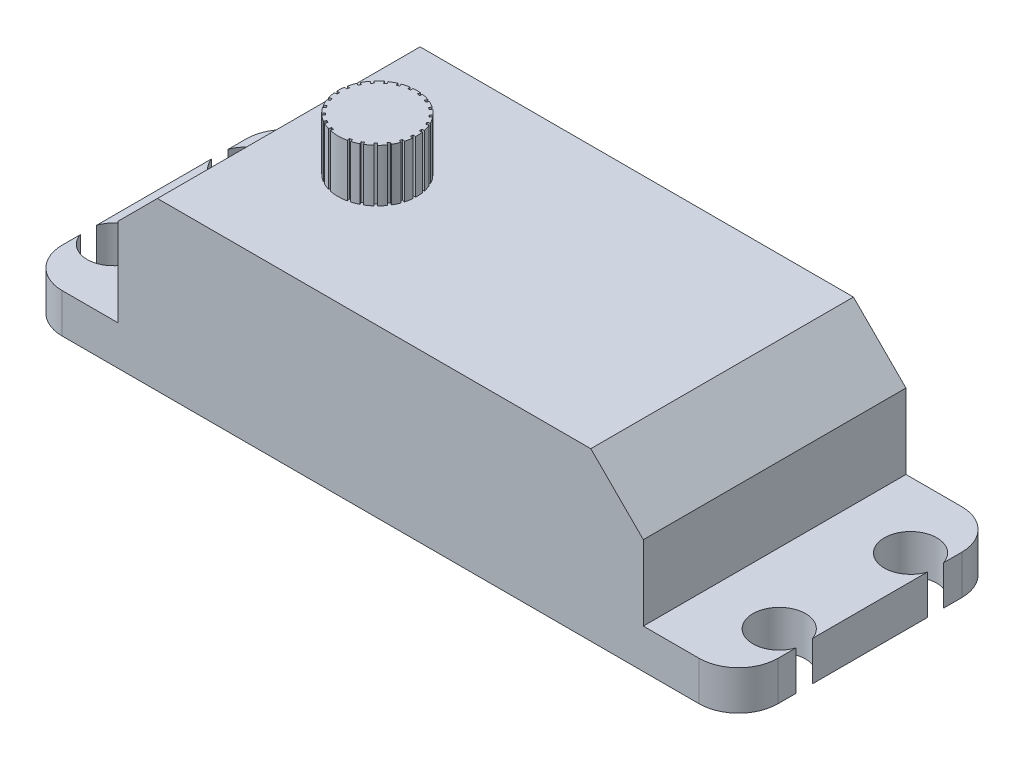
from build123d import *

# Parameters (mm, degrees)
SKETCH_1_W               = 40
SKETCH_1_H               = 12.7
EXTRUDE_1_DEPTH          = 20
EXTRUDE_4_DEPTH          = 3
SKETCH_4_R               = 2
CUT_EXTRUDE_1_DEPTH      = 3
CHAMFER_2_SIZE           = 4
CHAMFER_3_SIZE           = 3
SKETCH_5_R               = 3
EXTRUDE_5_DEPTH          = 4
SKETCH_6_W               = 0.2
SKETCH_6_H               = 4
CUT_EXTRUDE_2_DEPTH      = 0.2
PATTERN_CIRCULAR_1_COUNT = 25


with BuildPart() as part:
    # 草图1 → 凸台-拉伸1 (new body)
    with BuildSketch(Plane.XY):
        Rectangle(SKETCH_1_W, SKETCH_1_H)
    extrude(amount=EXTRUDE_1_DEPTH)

    # 草图3 → 凸台-拉伸4 (add)
    with BuildSketch(Plane.XZ.offset(6.35)):
        with BuildLine():
            Line((-20, 20), (-24.25, 20))
            ThreePointArc((-24.25, 20), (-26.371320344, 19.121320344), (-27.25, 17))
            Line((-27.25, 17), (-27.25, 3))
            ThreePointArc((-27.25, 3), (-26.371320344, 0.878679656), (-24.25, 0))
            Line((-24.25, 0), (-20, 0))
            Line((-20, 0), (-20, 20))
        make_face()
        with BuildLine():
            Line((20, 20), (24.25, 20))
            ThreePointArc((24.25, 20), (26.371320344, 19.121320344), (27.25, 17))
            Line((27.25, 17), (27.25, 3))
            ThreePointArc((27.25, 3), (26.371320344, 0.878679656), (24.25, 0))
            Line((24.25, 0), (20, 0))
            Line((20, 0), (20, 20))
        make_face()
    extrude(amount=-EXTRUDE_4_DEPTH)

    # 草图4 → 切除-拉伸1 (cut)
    with BuildSketch(Plane.XZ.offset(6.35)):
        with Locations((-25.35, 15)):
            Circle(SKETCH_4_R)
        with Locations((-25.35, 5)):
            Circle(SKETCH_4_R)
        with Locations((25.35, 15)):
            Circle(SKETCH_4_R)
        with Locations((25.35, 5)):
            Circle(SKETCH_4_R)
    extrude(amount=-CUT_EXTRUDE_1_DEPTH, mode=Mode.SUBTRACT)

    # 倒角2
    chamfer_2_edges = [part.edges().sort_by_distance(p)[0] for p in [
        (20, 6.35, 10),
    ]]
    chamfer(chamfer_2_edges, length=CHAMFER_2_SIZE)

    # 倒角3
    chamfer_3_edges = [part.edges().sort_by_distance(p)[0] for p in [
        (-20, 6.35, 10),
    ]]
    chamfer(chamfer_3_edges, length=CHAMFER_3_SIZE)

    # 草图5 → 凸台-拉伸5 (add)
    with BuildSketch(Plane(origin=(0, 6.35, 0), x_dir=(1, 0, 0), z_dir=(0, 1, 0))):
        with Locations(Location((-10.25, -10, 0), (0, 0, 90))):
            Circle(SKETCH_5_R)
    extrude_5 = extrude(amount=EXTRUDE_5_DEPTH)

    # 草图6 → 切除-拉伸2 (cut)
    with BuildSketch(Plane.XY.offset(13)):
        with Locations((-10.25, 8.35)):
            Rectangle(SKETCH_6_W, SKETCH_6_H)
    cut_extrude_2 = extrude(amount=-CUT_EXTRUDE_2_DEPTH, mode=Mode.SUBTRACT)

    # 阵列(圆周)1: 凸台-拉伸5, 切除-拉伸2 ×25 about axis
    pattern_circular_1_axis = Axis((-10.25, 10.35, 10), (0, -1, 0))
    add([extrude_5.rotate(pattern_circular_1_axis, i * 360 / PATTERN_CIRCULAR_1_COUNT) for i in range(1, PATTERN_CIRCULAR_1_COUNT)])
    add([cut_extrude_2.rotate(pattern_circular_1_axis, i * 360 / PATTERN_CIRCULAR_1_COUNT) for i in range(1, PATTERN_CIRCULAR_1_COUNT)], mode=Mode.SUBTRACT)


solid = part.part
